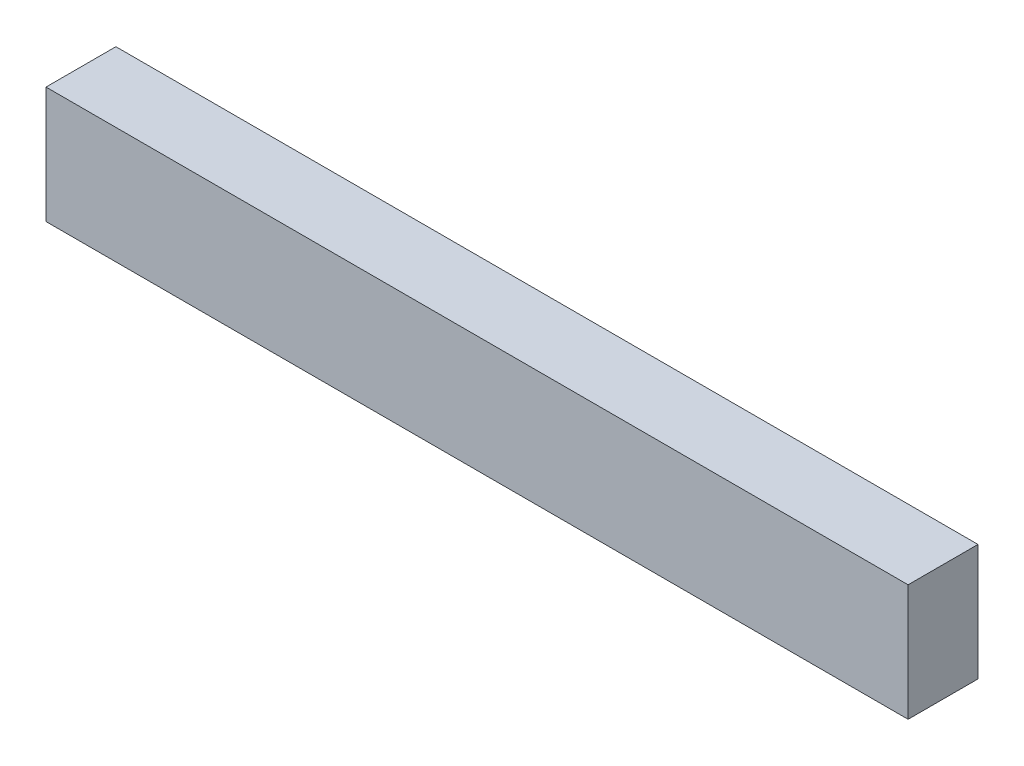
from build123d import *

# Parameters (mm, degrees)
SKETCH1_W           = 234.95
SKETCH1_H           = 19.05
BOSS_EXTRUDE1_DEPTH = 31.75


with BuildPart() as part:
    # Sketch1 → Boss-Extrude1 (new body)
    with BuildSketch(Plane(origin=(0, 0, 0), x_dir=(1, 0, 0), z_dir=(0, 1, 0))):
        Rectangle(SKETCH1_W, SKETCH1_H)
    extrude(amount=BOSS_EXTRUDE1_DEPTH)


solid = part.part
